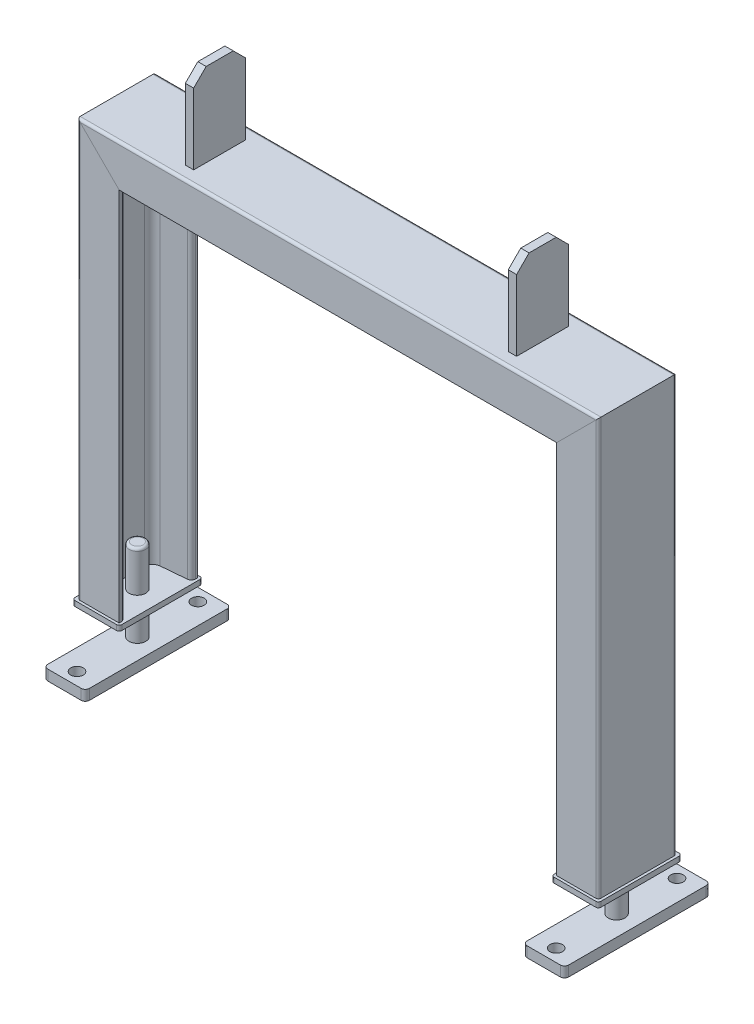
from build123d import *

# Parameters (mm, degrees)
CHANNEL_C_75_X_40_X_5_0_1_DEPTH        = 523.5
CHANNEL_C_75_X_40_X_5_0_1_2_DEPTH      = 747
CHANNEL_C_75_X_40_X_5_0_1_3_DEPTH      = 400
CHANNEL_C_75_X_40_X_5_0_1_3_DEPTH_BACK = 123.5
SKETCH15_R                             = 8
BOSS_EXTRUDE1_DEPTH                    = 5
BOSS_EXTRUDE1_2_DEPTH                  = 5
FILLET1_R                              = 2.5
FILLET2_R                              = 2.5
FILLET3_R                              = 2.5
SKETCH16_W                             = 8
SKETCH16_H                             = 50
BOSS_EXTRUDE2_DEPTH                    = 80
BOSS_EXTRUDE2_2_DEPTH                  = 80
CHAMFER1_SIZE                          = 12
CHAMFER2_SIZE                          = 12
BOSS_EXTRUDE3_DEPTH                    = 35
BOSS_EXTRUDE3_DEPTH_BACK               = 44
SKETCH17_R                             = 8
BOSS_EXTRUDE3_2_DEPTH                  = 35
BOSS_EXTRUDE3_2_DEPTH_BACK             = 44
FILLET6_R                              = 2.5
FILLET7_R                              = 2.5
SKETCH18_R                             = 6
BOSS_EXTRUDE4_DEPTH                    = 10
BOSS_EXTRUDE4_2_DEPTH                  = 10


with BuildPart() as part:
    # Sketch14 on segment 1 (carried to segment 1) → Channel C 75 X 40 X 5.0(1) (new body)
    with BuildSketch(Plane(origin=(250, -400, -37.5), x_dir=(-1, 0, 0), z_dir=(0, 1, 0))):
        with BuildLine():
            Line((40, 75), (0, 75))
            Line((0, 75), (0, 0))
            Line((0, 0), (40, 0))
            Line((40, 0), (40, 1.803623692))
            ThreePointArc((40, 1.803623692), (38.949109347, 4.505984523), (36.348622971, 5.788402485))
            Line((36.348622971, 5.788402485), (12.302754058, 7.892143419))
            ThreePointArc((12.302754058, 7.892143419), (7.101781306, 10.456979343), (5, 15.861701004))
            Line((5, 15.861701004), (5, 59.138298996))
            ThreePointArc((5, 59.138298996), (7.101781306, 64.543020657), (12.302754058, 67.107856581))
            Line((12.302754058, 67.107856581), (36.348622971, 69.211597515))
            ThreePointArc((36.348622971, 69.211597515), (38.949109347, 70.494015477), (40, 73.196376308))
            Line((40, 73.196376308), (40, 75))
        make_face()
    extrude(amount=CHANNEL_C_75_X_40_X_5_0_1_DEPTH)

    # Channel C 75 X 40 X 5.0(1) mitre 1
    split(bisect_by=Plane(origin=(250, 0, 0), x_dir=(0.707106781, 0.707106781, 0), z_dir=(0.707106781, -0.707106781, 0)), keep=Keep.TOP)

    # Fillet3
    fillet3_edges = [part.edges().sort_by_distance(p)[0] for p in [
        (250, -200, 37.5),
        (250, -200, -37.5),
    ]]
    fillet(fillet3_edges, radius=FILLET3_R)


with BuildPart() as body_2:
    # Sketch14 on segment 2 (carried to segment 2) → Channel C 75 X 40 X 5.0_1 2 (new body)
    with BuildSketch(Plane(origin=(373.5, 0, -37.5), x_dir=(0, -1, 0), z_dir=(-1, 0, 0))):
        with BuildLine():
            Line((40, 75), (0, 75))
            Line((0, 75), (0, 0))
            Line((0, 0), (40, 0))
            Line((40, 0), (40, 1.803623692))
            ThreePointArc((40, 1.803623692), (38.949109347, 4.505984523), (36.348622971, 5.788402485))
            Line((36.348622971, 5.788402485), (12.302754058, 7.892143419))
            ThreePointArc((12.302754058, 7.892143419), (7.101781306, 10.456979343), (5, 15.861701004))
            Line((5, 15.861701004), (5, 59.138298996))
            ThreePointArc((5, 59.138298996), (7.101781306, 64.543020657), (12.302754058, 67.107856581))
            Line((12.302754058, 67.107856581), (36.348622971, 69.211597515))
            ThreePointArc((36.348622971, 69.211597515), (38.949109347, 70.494015477), (40, 73.196376308))
            Line((40, 73.196376308), (40, 75))
        make_face()
    extrude(amount=CHANNEL_C_75_X_40_X_5_0_1_2_DEPTH)

    # Channel C 75 X 40 X 5.0_1 2 mitre 1
    split(bisect_by=Plane(origin=(250, 0, 0), x_dir=(-0.707106781, -0.707106781, 0), z_dir=(-0.707106781, 0.707106781, 0)), keep=Keep.TOP)

    # Channel C 75 X 40 X 5.0_1 2 mitre 2
    split(bisect_by=Plane(origin=(-250, 0, 0), x_dir=(-0.707106781, 0.707106781, 0), z_dir=(0.707106781, 0.707106781, 0)), keep=Keep.TOP)

    # Fillet2
    fillet2_edges = [body_2.edges().sort_by_distance(p)[0] for p in [
        (0, 0, 37.5),
        (0, 0, -37.5),
    ]]
    fillet(fillet2_edges, radius=FILLET2_R)


with BuildPart() as body_3:
    # Sketch14 → Channel C 75 X 40 X 5.0_1 3 (new, two sides: drawn at the far end of the back side and taken through both)
    with BuildSketch(Plane(origin=(-250, 0, -37.5), x_dir=(1, 0, 0), z_dir=(0, -1, 0)).offset(-CHANNEL_C_75_X_40_X_5_0_1_3_DEPTH_BACK)):
        with BuildLine():
            Line((40, 75), (0, 75))
            Line((0, 75), (0, 0))
            Line((0, 0), (40, 0))
            Line((40, 0), (40, 1.803623692))
            ThreePointArc((40, 1.803623692), (38.949109347, 4.505984523), (36.348622971, 5.788402485))
            Line((36.348622971, 5.788402485), (12.302754058, 7.892143419))
            ThreePointArc((12.302754058, 7.892143419), (7.101781306, 10.456979343), (5, 15.861701004))
            Line((5, 15.861701004), (5, 59.138298996))
            ThreePointArc((5, 59.138298996), (7.101781306, 64.543020657), (12.302754058, 67.107856581))
            Line((12.302754058, 67.107856581), (36.348622971, 69.211597515))
            ThreePointArc((36.348622971, 69.211597515), (38.949109347, 70.494015477), (40, 73.196376308))
            Line((40, 73.196376308), (40, 75))
        make_face()
    extrude(amount=CHANNEL_C_75_X_40_X_5_0_1_3_DEPTH + CHANNEL_C_75_X_40_X_5_0_1_3_DEPTH_BACK)

    # Channel C 75 X 40 X 5.0_1 3 mitre 1
    split(bisect_by=Plane(origin=(-250, 0, 0), x_dir=(0.707106781, -0.707106781, 0), z_dir=(-0.707106781, -0.707106781, 0)), keep=Keep.TOP)

    # Fillet1
    fillet1_edges = [body_3.edges().sort_by_distance(p)[0] for p in [
        (-250, -200, 37.5),
        (-250, -200, -37.5),
    ]]
    fillet(fillet1_edges, radius=FILLET1_R)


with BuildPart() as body_4:
    # Sketch15 → Boss-Extrude1 (new body)
    with BuildSketch(Plane.XZ.offset(400)):
        with BuildLine():
            Line((-252.5, 37.5), (-252.5, -37.5))
            ThreePointArc((-252.5, -37.5), (-251.767766953, -39.267766953), (-250, -40))
            Line((-250, -40), (-210, -40))
            ThreePointArc((-210, -40), (-208.232233047, -39.267766953), (-207.5, -37.5))
            Line((-207.5, -37.5), (-207.5, 37.5))
            ThreePointArc((-207.5, 37.5), (-208.232233047, 39.267766953), (-210, 40))
            Line((-210, 40), (-250, 40))
            ThreePointArc((-250, 40), (-251.767766953, 39.267766953), (-252.5, 37.5))
        make_face()
        with Locations((-230, 0)):
            Circle(SKETCH15_R, mode=Mode.SUBTRACT)
    extrude(amount=BOSS_EXTRUDE1_DEPTH)


with BuildPart() as body_5:
    # Sketch15 → Boss-Extrude1 2 (new body)
    with BuildSketch(Plane.XZ.offset(400)):
        with BuildLine():
            Line((252.5, -37.5), (252.5, 37.5))
            ThreePointArc((252.5, 37.5), (251.767766953, 39.267766953), (250, 40))
            Line((250, 40), (210, 40))
            ThreePointArc((210, 40), (208.232233047, 39.267766953), (207.5, 37.5))
            Line((207.5, 37.5), (207.5, -37.5))
            ThreePointArc((207.5, -37.5), (208.232233047, -39.267766953), (210, -40))
            Line((210, -40), (250, -40))
            ThreePointArc((250, -40), (251.767766953, -39.267766953), (252.5, -37.5))
        make_face()
        with Locations(Location((230, 0, 0), (0, 0, 180))):
            Circle(SKETCH15_R, mode=Mode.SUBTRACT)
    extrude(amount=BOSS_EXTRUDE1_2_DEPTH)


with BuildPart() as body_6:
    # Sketch16 → Boss-Extrude2 (new body)
    with BuildSketch(Plane(origin=(0, 0, 0), x_dir=(1, 0, 0), z_dir=(0, 1, 0))):
        with Locations((-155, 0)):
            Rectangle(SKETCH16_W, SKETCH16_H)
    extrude(amount=BOSS_EXTRUDE2_DEPTH)

    # Chamfer1
    chamfer1_edges = [body_6.edges().sort_by_distance(p)[0] for p in [
        (-155, 80, -25),
        (-155, 80, 25),
    ]]
    chamfer(chamfer1_edges, length=CHAMFER1_SIZE)


with BuildPart() as body_7:
    # Sketch16 → Boss-Extrude2 2 (new body)
    with BuildSketch(Plane(origin=(0, 0, 0), x_dir=(1, 0, 0), z_dir=(0, 1, 0))):
        with Locations((155, 0)):
            Rectangle(SKETCH16_W, SKETCH16_H)
    extrude(amount=BOSS_EXTRUDE2_2_DEPTH)

    # Chamfer2
    chamfer2_edges = [body_7.edges().sort_by_distance(p)[0] for p in [
        (155, 80, 25),
        (155, 80, -25),
    ]]
    chamfer(chamfer2_edges, length=CHAMFER2_SIZE)


with BuildPart() as body_8:
    # Sketch17 → Boss-Extrude3 (new, two sides: drawn at the far end of the back side and taken through both)
    with BuildSketch(Plane.XZ.offset(405).offset(-BOSS_EXTRUDE3_DEPTH_BACK)):
        with Locations((-230, 0)):
            Circle(SKETCH17_R)
    extrude(amount=BOSS_EXTRUDE3_DEPTH + BOSS_EXTRUDE3_DEPTH_BACK)

    # Fillet6
    fillet6_edges = [body_8.edges().sort_by_distance(p)[0] for p in [
        (-238, -361, 0),
    ]]
    fillet(fillet6_edges, radius=FILLET6_R)


with BuildPart() as body_9:
    # Sketch17 → Boss-Extrude3 2 (new, two sides: drawn at the far end of the back side and taken through both)
    with BuildSketch(Plane.XZ.offset(405).offset(-BOSS_EXTRUDE3_2_DEPTH_BACK)):
        with Locations(Location((230, 0, 0), (0, 0, 180))):
            Circle(SKETCH17_R)
    extrude(amount=BOSS_EXTRUDE3_2_DEPTH + BOSS_EXTRUDE3_2_DEPTH_BACK)

    # Fillet7
    fillet7_edges = [body_9.edges().sort_by_distance(p)[0] for p in [
        (238, -361, 0),
    ]]
    fillet(fillet7_edges, radius=FILLET7_R)


with BuildPart() as body_10:
    # Sketch18 → Boss-Extrude4 (new body)
    with BuildSketch(Plane.XZ.offset(440)):
        with BuildLine():
            Line((-246, -70), (-214, -70))
            ThreePointArc((-214, -70), (-211.171572875, -68.828427125), (-210, -66))
            Line((-210, -66), (-210, 66))
            ThreePointArc((-210, 66), (-211.171572875, 68.828427125), (-214, 70))
            Line((-214, 70), (-246, 70))
            ThreePointArc((-246, 70), (-248.828427125, 68.828427125), (-250, 66))
            Line((-250, 66), (-250, -66))
            ThreePointArc((-250, -66), (-248.828427125, -68.828427125), (-246, -70))
        make_face()
        with Locations((-230, 58)):
            Circle(SKETCH18_R, mode=Mode.SUBTRACT)
        with Locations((-230, -58)):
            Circle(SKETCH18_R, mode=Mode.SUBTRACT)
    extrude(amount=BOSS_EXTRUDE4_DEPTH)


with BuildPart() as body_11:
    # Sketch18 → Boss-Extrude4 2 (new body)
    with BuildSketch(Plane.XZ.offset(440)):
        with BuildLine():
            Line((210, -66), (210, 66))
            ThreePointArc((210, 66), (211.171572875, 68.828427125), (214, 70))
            Line((214, 70), (246, 70))
            ThreePointArc((246, 70), (248.828427125, 68.828427125), (250, 66))
            Line((250, 66), (250, -66))
            ThreePointArc((250, -66), (248.828427125, -68.828427125), (246, -70))
            Line((246, -70), (214, -70))
            ThreePointArc((214, -70), (211.171572875, -68.828427125), (210, -66))
        make_face()
        with Locations(Location((230, -58, 0), (0, 0, 180))):
            Circle(SKETCH18_R, mode=Mode.SUBTRACT)
        with Locations(Location((230, 58, 0), (0, 0, 180))):
            Circle(SKETCH18_R, mode=Mode.SUBTRACT)
    extrude(amount=BOSS_EXTRUDE4_2_DEPTH)


solid = Compound([part.part, body_2.part, body_3.part, body_4.part, body_5.part, body_6.part, body_7.part, body_8.part, body_9.part, body_10.part, body_11.part])
